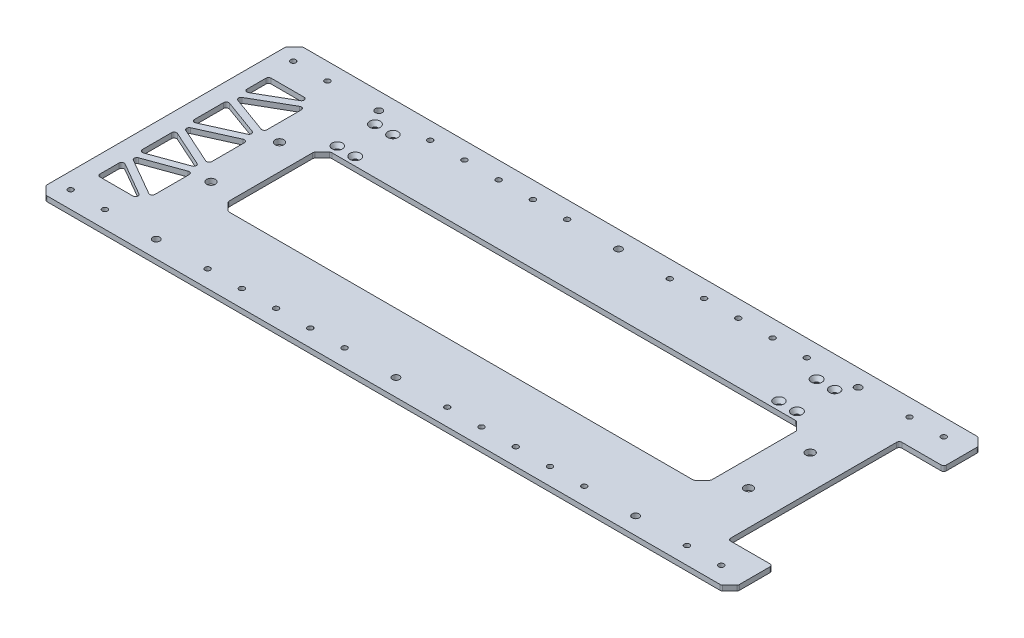
from build123d import *
from OCP.BRepFilletAPI import BRepFilletAPI_MakeChamfer

# Parameters (mm, degrees)
SKETCH_2_W          = 410
SKETCH_2_H          = 150
EXTRUDE_1_DEPTH     = 3
SKETCH_4_R          = 2.05
SKETCH_4_R_2        = 1.55
CUT_EXTRUDE_1_DEPTH = 3
SKETCH_5_R          = 2.55
CUT_EXTRUDE_2_DEPTH = 3
SKETCH_7_W          = 282
SKETCH_7_H          = 60
CUT_EXTRUDE_3_DEPTH = 3
CHAMFER_1_SIZE      = 5
FILLET_1_R          = 1.5
SKETCH_8_W          = 5.621320344
SKETCH_8_H          = 150
CUT_EXTRUDE_4_DEPTH = 3
CHAMFER_2_SIZE      = 5
CUT_EXTRUDE_5_DEPTH = 20
SKETCH_11_R         = 1.6
SKETCH_11_R_2       = 1.5
CUT_EXTRUDE_6_DEPTH = 10
SKETCH_12_W         = 26
SKETCH_12_H         = 100
CUT_EXTRUDE_7_DEPTH = 10
FILLET_2_R          = 1.5
CHAMFER_3_SIZE      = 2.5
CHAMFER_3_SIZE2     = 1.5


with BuildPart() as part:
    # 草图2 → 凸台-拉伸1 (new body)
    with BuildSketch(Plane(origin=(0, 0, 0), x_dir=(1, 0, 0), z_dir=(0, 1, 0))):
        Rectangle(SKETCH_2_W, SKETCH_2_H)
    extrude(amount=EXTRUDE_1_DEPTH)

    # 草图4 → 切除-拉伸1 (cut)
    with BuildSketch(Plane(origin=(0, 3, 0), x_dir=(1, 0, 0), z_dir=(0, 1, 0))):
        with Locations(Location((0, 65, 0), (0, 0, 270))):
            Circle(SKETCH_4_R)
        with Locations(Location((140, 65, 0), (0, 0, 270))):
            Circle(SKETCH_4_R)
        with Locations(Location((-140, 65, 0), (0, 0, 90))):
            Circle(SKETCH_4_R)
        with Locations(Location((-140, -65, 0), (0, 0, 270))):
            Circle(SKETCH_4_R)
        with Locations(Location((140, -65, 0), (0, 0, 90))):
            Circle(SKETCH_4_R)
        with Locations(Location((0, -65, 0), (0, 0, 90))):
            Circle(SKETCH_4_R)
        with Locations(Location((-190, 65, 0), (0, 0, 270))):
            Circle(SKETCH_4_R_2)
        with Locations(Location((-170, 65, 0), (0, 0, 270))):
            Circle(SKETCH_4_R_2)
        with Locations(Location((-110, 65, 0), (0, 0, 270))):
            Circle(SKETCH_4_R_2)
        with Locations(Location((-90, 65, 0), (0, 0, 270))):
            Circle(SKETCH_4_R_2)
        with Locations(Location((-70, 65, 0), (0, 0, 270))):
            Circle(SKETCH_4_R_2)
        with Locations(Location((-50, 65, 0), (0, 0, 270))):
            Circle(SKETCH_4_R_2)
        with Locations(Location((-30, 65, 0), (0, 0, 270))):
            Circle(SKETCH_4_R_2)
        with Locations(Location((30, 65, 0), (0, 0, 270))):
            Circle(SKETCH_4_R_2)
        with Locations(Location((50, 65, 0), (0, 0, 270))):
            Circle(SKETCH_4_R_2)
        with Locations(Location((70, 65, 0), (0, 0, 270))):
            Circle(SKETCH_4_R_2)
        with Locations(Location((90, 65, 0), (0, 0, 270))):
            Circle(SKETCH_4_R_2)
        with Locations(Location((110, 65, 0), (0, 0, 270))):
            Circle(SKETCH_4_R_2)
        with Locations(Location((110, -65, 0), (0, 0, 90))):
            Circle(SKETCH_4_R_2)
        with Locations(Location((90, -65, 0), (0, 0, 90))):
            Circle(SKETCH_4_R_2)
        with Locations(Location((70, -65, 0), (0, 0, 90))):
            Circle(SKETCH_4_R_2)
        with Locations(Location((50, -65, 0), (0, 0, 90))):
            Circle(SKETCH_4_R_2)
        with Locations(Location((30, -65, 0), (0, 0, 90))):
            Circle(SKETCH_4_R_2)
        with Locations(Location((-30, -65, 0), (0, 0, 90))):
            Circle(SKETCH_4_R_2)
        with Locations(Location((-50, -65, 0), (0, 0, 90))):
            Circle(SKETCH_4_R_2)
        with Locations(Location((-70, -65, 0), (0, 0, 90))):
            Circle(SKETCH_4_R_2)
        with Locations(Location((-90, -65, 0), (0, 0, 90))):
            Circle(SKETCH_4_R_2)
        with Locations(Location((-110, -65, 0), (0, 0, 90))):
            Circle(SKETCH_4_R_2)
        with Locations(Location((-170, -65, 0), (0, 0, 90))):
            Circle(SKETCH_4_R_2)
        with Locations(Location((-190, -65, 0), (0, 0, 90))):
            Circle(SKETCH_4_R_2)
        with Locations(Location((170, 65, 0), (0, 0, 270))):
            Circle(SKETCH_4_R_2)
        with Locations(Location((190, 65, 0), (0, 0, 270))):
            Circle(SKETCH_4_R_2)
        with Locations(Location((170, -65, 0), (0, 0, 90))):
            Circle(SKETCH_4_R_2)
        with Locations(Location((190, -65, 0), (0, 0, 90))):
            Circle(SKETCH_4_R_2)
    extrude(amount=-CUT_EXTRUDE_1_DEPTH, mode=Mode.SUBTRACT)

    # 草图5 → 切除-拉伸2 (cut)
    with BuildSketch(Plane(origin=(0, 3, 0), x_dir=(1, 0, 0), z_dir=(0, 1, 0))):
        with Locations(Location((-153, 20, 0), (0, 0, 270))):
            Circle(SKETCH_5_R)
        with Locations(Location((-153, -20, 0), (0, 0, 90))):
            Circle(SKETCH_5_R)
        with Locations(Location((159, 18, 0), (0, 0, 270))):
            Circle(SKETCH_5_R)
        with Locations(Location((159, -18, 0), (0, 0, 90))):
            Circle(SKETCH_5_R)
    extrude(amount=-CUT_EXTRUDE_2_DEPTH, mode=Mode.SUBTRACT)

    # 草图7 → 切除-拉伸3 (cut)
    with BuildSketch(Plane(origin=(0, 3, 0), x_dir=(1, 0, 0), z_dir=(0, 1, 0))):
        with Locations((3, 0)):
            Rectangle(SKETCH_7_W, SKETCH_7_H)
    extrude(amount=-CUT_EXTRUDE_3_DEPTH, mode=Mode.SUBTRACT)

    # 倒角1
    chamfer_1_edges = [part.edges().sort_by_distance(p)[0] for p in [
        (-138, 1.5, 30),
        (-138, 1.5, -30),
        (144, 1.5, -30),
        (144, 1.5, 30),
        (-205, 1.5, -75),
        (205, 1.5, -75),
        (205, 1.5, 75),
        (-205, 1.5, 75),
    ]]
    chamfer(chamfer_1_edges, length=CHAMFER_1_SIZE)

    # 圆角1
    fillet_1_edges = [part.edges().sort_by_distance(p)[0] for p in [
        (144, 1.5, -25),
        (144, 1.5, 25),
        (-133, 1.5, 30),
        (139, 1.5, 30),
        (-133, 1.5, -30),
        (139, 1.5, -30),
        (-138, 1.5, -25),
        (-138, 1.5, 25),
        (200, 1.5, 75),
        (-200, 1.5, 75),
        (-205, 1.5, -70),
        (-205, 1.5, 70),
        (205, 1.5, -70),
        (205, 1.5, 70),
        (-200, 1.5, -75),
        (200, 1.5, -75),
    ]]
    fillet(fillet_1_edges, radius=FILLET_1_R)

    # 草图8 → 切除-拉伸4 (cut)
    with BuildSketch(Plane(origin=(0, 3, 0), x_dir=(1, 0, 0), z_dir=(0, 1, 0))):
        with Locations((-202.189339828, 0)):
            Rectangle(SKETCH_8_W, SKETCH_8_H)
    extrude(amount=-CUT_EXTRUDE_4_DEPTH, mode=Mode.SUBTRACT)

    # 倒角2
    chamfer_2_edges = [part.edges().sort_by_distance(p)[0] for p in [
        (-199.378679656, 1.5, -75),
        (-199.378679656, 1.5, 75),
    ]]
    chamfer(chamfer_2_edges, length=CHAMFER_2_SIZE)

    # 草图9 → 切除-拉伸5 (cut)
    with BuildSketch(Plane(origin=(0, 3, 0), x_dir=(1, 0, 0), z_dir=(0, 1, 0))):
        Polygon((-163, 50), (-189.378679656, 50), (-189.378679656, 34.770262199), align=None)
        Polygon((-163, 20.550405832), (-163, 45.381197846), (-189.378679656, 30.151460046), align=None)
        Polygon((-163, 16.293694742), (-189.378679656, 25.894748956), (-189.378679656, 4.388509296), align=None)
        Polygon((-163, -11.905185446), (-163, 11.905185446), (-189.378679656, 0), align=None)
        Polygon((-163, -16.293694742), (-189.378679656, -4.388509296), (-189.378679656, -25.894748956), align=None)
        Polygon((-163, -45.381197846), (-163, -20.550405832), (-189.378679656, -30.151460046), align=None)
        Polygon((-163, -50), (-189.378679656, -34.770262199), (-189.378679656, -50), align=None)
    extrude(amount=-CUT_EXTRUDE_5_DEPTH, mode=Mode.SUBTRACT)

    # 草图11 → 切除-拉伸6 (cut)
    with BuildSketch(Plane(origin=(0, 3, 0), x_dir=(1, 0, 0), z_dir=(0, 1, 0))):
        with Locations(Location((-134.25, 57, 0), (0, 0, 270))):
            Circle(SKETCH_11_R)
        with Locations(Location((-123.75, 57, 0), (0, 0, 270))):
            Circle(SKETCH_11_R_2)
        with Locations(Location((-134.25, 35, 0), (0, 0, 270))):
            Circle(SKETCH_11_R_2)
        with Locations(Location((-123.75, 35, 0), (0, 0, 270))):
            Circle(SKETCH_11_R)
        with Locations(Location((123.75, 57, 0), (0, 0, 270))):
            Circle(SKETCH_11_R)
        with Locations(Location((134.25, 57, 0), (0, 0, 270))):
            Circle(SKETCH_11_R_2)
        with Locations(Location((123.75, 35, 0), (0, 0, 270))):
            Circle(SKETCH_11_R_2)
        with Locations(Location((134.25, 35, 0), (0, 0, 270))):
            Circle(SKETCH_11_R)
    extrude(amount=-CUT_EXTRUDE_6_DEPTH, mode=Mode.SUBTRACT)

    # 草图12 → 切除-拉伸7 (cut)
    with BuildSketch(Plane(origin=(0, 3, 0), x_dir=(1, 0, 0), z_dir=(0, 1, 0))):
        with Locations((192, 0)):
            Rectangle(SKETCH_12_W, SKETCH_12_H)
    extrude(amount=-CUT_EXTRUDE_7_DEPTH, mode=Mode.SUBTRACT)

    # 圆角2
    fillet_2_edges = [part.edges().sort_by_distance(p)[0] for p in [
        (-194.378679656, 1.5, 75),
        (-199.378679656, 1.5, -70),
        (-199.378679656, 1.5, 70),
        (-194.378679656, 1.5, -75),
        (-189.378679656, 1.5, 0),
        (-163, 1.5, -11.905185446),
        (-163, 1.5, 11.905185446),
        (-189.378679656, 1.5, 25.894748956),
        (-189.378679656, 1.5, 4.388509296),
        (-163, 1.5, 16.293694742),
        (-189.378679656, 1.5, -30.151460046),
        (-163, 1.5, -45.381197846),
        (-163, 1.5, -20.550405832),
        (-163, 1.5, -16.293694742),
        (-189.378679656, 1.5, -4.388509296),
        (-189.378679656, 1.5, -25.894748956),
        (-163, 1.5, 50),
        (-189.378679656, 1.5, 50),
        (-189.378679656, 1.5, 34.770262199),
        (-189.378679656, 1.5, 30.151460046),
        (-163, 1.5, 20.550405832),
        (-163, 1.5, 45.381197846),
        (-163, 1.5, -50),
        (-189.378679656, 1.5, -34.770262199),
        (-189.378679656, 1.5, -50),
        (205, 1.5, -50),
        (205, 1.5, 50),
        (179, 1.5, 50),
        (179, 1.5, -50),
    ]]
    fillet(fillet_2_edges, radius=FILLET_2_R)

    # 倒角3: one chamfer whose edges measure the first distance from different faces: ONE call of the kernel's chamfer builder (chamfer() names one face for all edges)
    chamfer_3_edges_1 = [part.edges().sort_by_distance(p)[0] for p in [
        (123.75, 3, -58.6),
    ]]
    chamfer_3_side_1 = [part.faces().sort_by_distance(p)[0] for p in [
        (123.75, 1.5, -58.6),
    ]]
    chamfer_3_edges_2 = [part.edges().sort_by_distance(p)[0] for p in [
        (-123.75, 3, -36.6),
    ]]
    chamfer_3_side_2 = [part.faces().sort_by_distance(p)[0] for p in [
        (-123.75, 1.5, -36.6),
    ]]
    chamfer_3_edges_3 = [part.edges().sort_by_distance(p)[0] for p in [
        (-134.25, 3, -36.5),
    ]]
    chamfer_3_side_3 = [part.faces().sort_by_distance(p)[0] for p in [
        (-134.25, 1.5, -36.5),
    ]]
    chamfer_3_edges_4 = [part.edges().sort_by_distance(p)[0] for p in [
        (-123.75, 3, -58.5),
    ]]
    chamfer_3_side_4 = [part.faces().sort_by_distance(p)[0] for p in [
        (-123.75, 1.5, -58.5),
    ]]
    chamfer_3_edges_5 = [part.edges().sort_by_distance(p)[0] for p in [
        (134.25, 3, -36.6),
    ]]
    chamfer_3_side_5 = [part.faces().sort_by_distance(p)[0] for p in [
        (134.25, 1.5, -36.6),
    ]]
    chamfer_3_edges_6 = [part.edges().sort_by_distance(p)[0] for p in [
        (123.75, 3, -36.5),
    ]]
    chamfer_3_side_6 = [part.faces().sort_by_distance(p)[0] for p in [
        (123.75, 1.5, -36.5),
    ]]
    chamfer_3_edges_7 = [part.edges().sort_by_distance(p)[0] for p in [
        (134.25, 3, -58.5),
    ]]
    chamfer_3_side_7 = [part.faces().sort_by_distance(p)[0] for p in [
        (134.25, 1.5, -58.5),
    ]]
    chamfer_3_edges_8 = [part.edges().sort_by_distance(p)[0] for p in [
        (-134.25, 3, -58.6),
    ]]
    chamfer_3_side_8 = [part.faces().sort_by_distance(p)[0] for p in [
        (-134.25, 1.5, -58.6),
    ]]
    chamfer_3 = BRepFilletAPI_MakeChamfer(part.part.solid().wrapped)
    for e in chamfer_3_edges_1:
        chamfer_3.Add(CHAMFER_3_SIZE, CHAMFER_3_SIZE2, e.wrapped, chamfer_3_side_1[0].wrapped)  # the first distance lies on this face
    for e in chamfer_3_edges_2:
        chamfer_3.Add(CHAMFER_3_SIZE, CHAMFER_3_SIZE2, e.wrapped, chamfer_3_side_2[0].wrapped)  # the first distance lies on this face
    for e in chamfer_3_edges_3:
        chamfer_3.Add(CHAMFER_3_SIZE, CHAMFER_3_SIZE2, e.wrapped, chamfer_3_side_3[0].wrapped)  # the first distance lies on this face
    for e in chamfer_3_edges_4:
        chamfer_3.Add(CHAMFER_3_SIZE, CHAMFER_3_SIZE2, e.wrapped, chamfer_3_side_4[0].wrapped)  # the first distance lies on this face
    for e in chamfer_3_edges_5:
        chamfer_3.Add(CHAMFER_3_SIZE, CHAMFER_3_SIZE2, e.wrapped, chamfer_3_side_5[0].wrapped)  # the first distance lies on this face
    for e in chamfer_3_edges_6:
        chamfer_3.Add(CHAMFER_3_SIZE, CHAMFER_3_SIZE2, e.wrapped, chamfer_3_side_6[0].wrapped)  # the first distance lies on this face
    for e in chamfer_3_edges_7:
        chamfer_3.Add(CHAMFER_3_SIZE, CHAMFER_3_SIZE2, e.wrapped, chamfer_3_side_7[0].wrapped)  # the first distance lies on this face
    for e in chamfer_3_edges_8:
        chamfer_3.Add(CHAMFER_3_SIZE, CHAMFER_3_SIZE2, e.wrapped, chamfer_3_side_8[0].wrapped)  # the first distance lies on this face
    add(Compound.cast(chamfer_3.Shape()), mode=Mode.REPLACE)


solid = part.part
